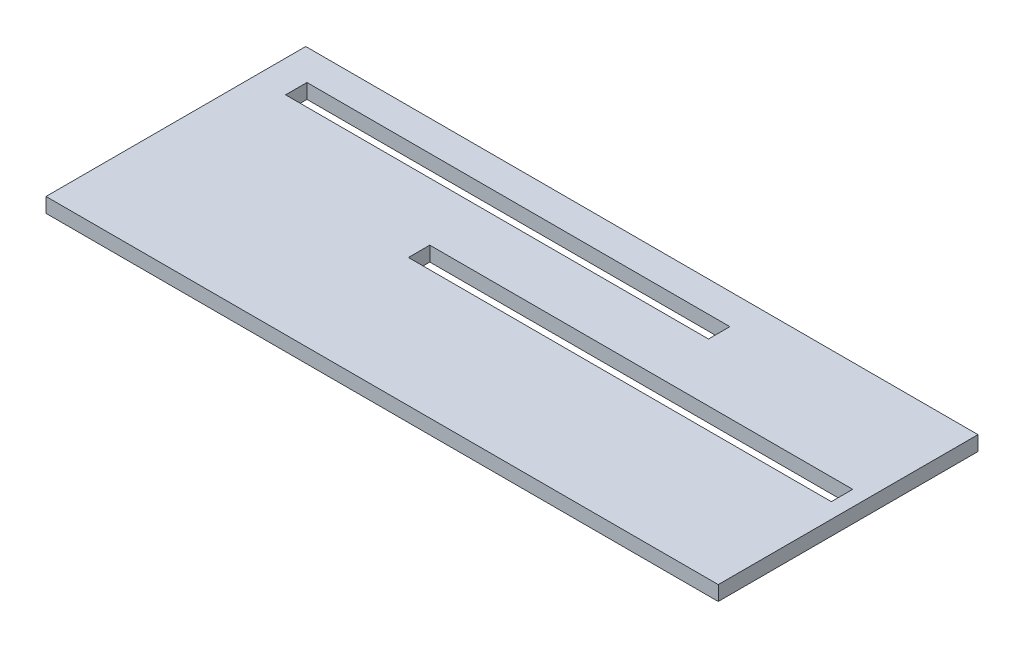
from build123d import *

# Parameters (mm, degrees)
SKETCH1_W           = 11
SKETCH1_H           = 4.25
SKETCH1_W_2         = 6.92
SKETCH1_H_2         = 0.35
BOSS_EXTRUDE1_DEPTH = 0.24


with BuildPart() as part:
    # Sketch1 → Boss-Extrude1 (new body)
    with BuildSketch(Plane(origin=(0, 0, 0), x_dir=(1, 0, 0), z_dir=(0, 1, 0))):
        with Locations((5.5, 2.125)):
            Rectangle(SKETCH1_W, SKETCH1_H)
        with Locations((3.98, 3.575)):
            Rectangle(SKETCH1_W_2, SKETCH1_H_2, mode=Mode.SUBTRACT)
        with Locations((7.29, 2.275)):
            Rectangle(SKETCH1_W_2, SKETCH1_H_2, mode=Mode.SUBTRACT)
    extrude(amount=BOSS_EXTRUDE1_DEPTH)


solid = part.part
